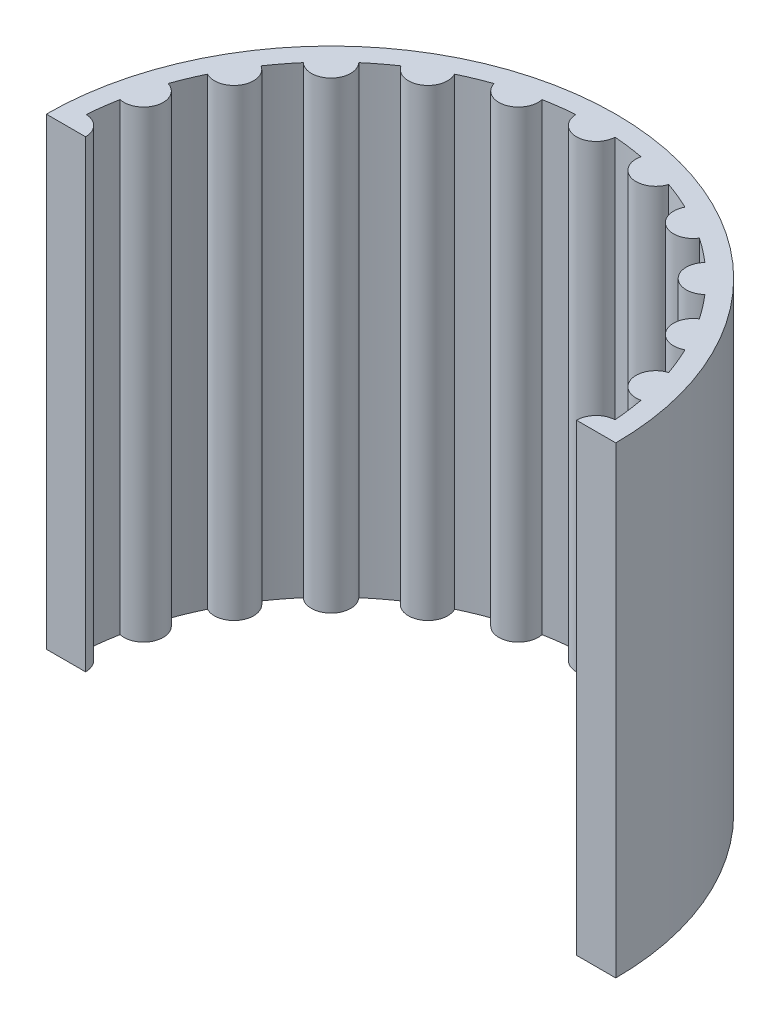
from build123d import *

# Parameters (mm, degrees)
BOSS_EXTRUDE1_DEPTH = 299.72


with BuildPart() as part:
    # Sketch1 → Boss-Extrude1 (new body)
    with BuildSketch(Plane(origin=(0, 0, 0), x_dir=(1, 0, 0), z_dir=(0, 1, 0))):
        with BuildLine():
            Line((158.75, 0), (184.15, 0))
            ThreePointArc((184.15, 0), (0, 184.15), (-184.15, 0))
            Line((-184.15, 0), (-158.75, 0))
            ThreePointArc((-158.75, 0), (-162.304954792, 8.812386064), (-170.97962963, 12.691286448))
            ThreePointArc((-170.97962963, 12.691286448), (-169.983221483, 22.378715656), (-168.438386668, 31.993943123))
            ThreePointArc((-168.438386668, 31.993943123), (-153.340724923, 41.08752341), (-161.868893389, 56.511625822))
            ThreePointArc((-161.868893389, 56.511625822), (-158.399145849, 65.611074479), (-154.418346013, 74.498838344))
            ThreePointArc((-154.418346013, 74.498838344), (-137.481532851, 79.375), (-141.727059565, 96.480791286))
            ThreePointArc((-141.727059565, 96.480791286), (-136.020430193, 104.372147004), (-129.874950266, 111.926760846))
            ThreePointArc((-129.874950266, 111.926760846), (-112.253201513, 112.253201513), (-111.926760846, 129.874950266))
            ThreePointArc((-111.926760846, 129.874950266), (-104.372147004, 136.020430193), (-96.480791286, 141.727059565))
            ThreePointArc((-96.480791286, 141.727059565), (-79.375, 137.481532851), (-74.498838344, 154.418346013))
            ThreePointArc((-74.498838344, 154.418346013), (-65.611074479, 158.399145849), (-56.511625822, 161.868893389))
            ThreePointArc((-56.511625822, 161.868893389), (-41.08752341, 153.340724923), (-31.993943123, 168.438386668))
            ThreePointArc((-31.993943123, 168.438386668), (-22.378715656, 169.983221483), (-12.691286448, 170.97962963))
            ThreePointArc((-12.691286448, 170.97962963), (0, 158.75), (12.691286448, 170.97962963))
            ThreePointArc((12.691286448, 170.97962963), (22.378715656, 169.983221483), (31.993943123, 168.438386668))
            ThreePointArc((31.993943123, 168.438386668), (41.08752341, 153.340724923), (56.511625822, 161.868893389))
            ThreePointArc((56.511625822, 161.868893389), (65.611074479, 158.399145849), (74.498838344, 154.418346013))
            ThreePointArc((74.498838344, 154.418346013), (79.375, 137.481532851), (96.480791286, 141.727059565))
            ThreePointArc((96.480791286, 141.727059565), (104.372147004, 136.020430193), (111.926760846, 129.874950266))
            ThreePointArc((111.926760846, 129.874950266), (112.253201513, 112.253201513), (129.874950266, 111.926760846))
            ThreePointArc((129.874950266, 111.926760846), (136.020430193, 104.372147004), (141.727059565, 96.480791286))
            ThreePointArc((141.727059565, 96.480791286), (137.481532851, 79.375), (154.418346013, 74.498838344))
            ThreePointArc((154.418346013, 74.498838344), (158.399145849, 65.611074479), (161.868893389, 56.511625822))
            ThreePointArc((161.868893389, 56.511625822), (153.340724923, 41.08752341), (168.438386668, 31.993943123))
            ThreePointArc((168.438386668, 31.993943123), (169.983221483, 22.378715656), (170.97962963, 12.691286448))
            ThreePointArc((170.97962963, 12.691286448), (162.304954792, 8.812386064), (158.75, 0))
        make_face()
    extrude(amount=-BOSS_EXTRUDE1_DEPTH)


solid = part.part
